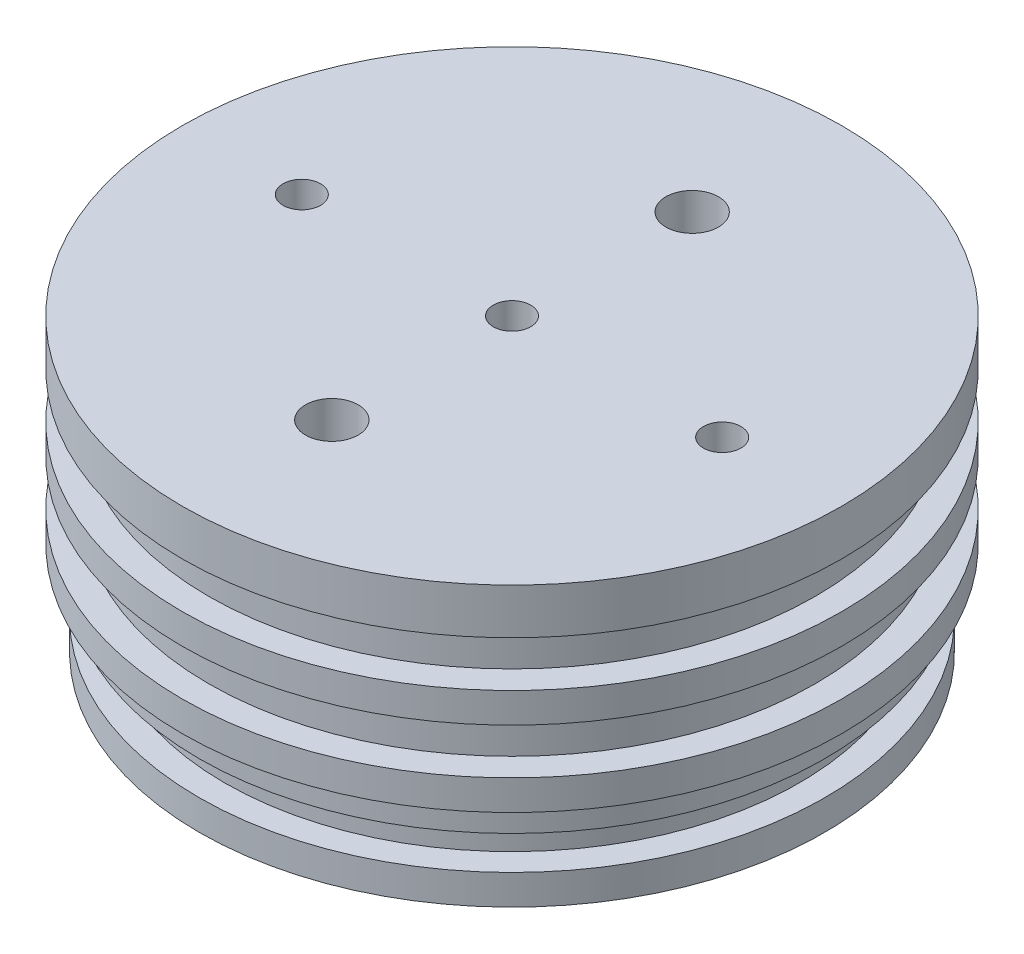
from build123d import *

# Parameters (mm, degrees)
SKETCH1_R                         = 69.723
BOSS_EXTRUDE1_DEPTH               = 41.656
SKETCH3_W                         = 5.588
SKETCH3_H                         = 9.652
SKETCH4_R                         = 66.167
BOSS_EXTRUDE2_DEPTH               = 19.8374
SKETCH5_W                         = 5.3975
SKETCH5_H                         = 7.1374
PIPE_TAP_DRILL_FOR_1_4_TAP1_D     = 11.1252
TAP_DRILL_FOR_3_8_16_TAP1_D       = 7.9375
TAP_DRILL_FOR_3_8_16_TAP1_DEPTH   = 25.4
TAP_DRILL_FOR_3_8_16_TAP1_TIP     = 2.384665582
PIPE_TAP_DRILL_FOR_1_4_TAP2_D     = 11.1252
PIPE_TAP_DRILL_FOR_1_4_TAP2_DEPTH = 61.4934
TAP_DRILL_FOR_3_8_16_TAP2_D       = 7.9375
TAP_DRILL_FOR_3_8_16_TAP2_DEPTH   = 19.05
TAP_DRILL_FOR_3_8_16_TAP2_TIP     = 2.384665582


with BuildPart() as part:
    # Sketch1 → Boss-Extrude1 (new body)
    with BuildSketch(Plane(origin=(0, 0, 0), x_dir=(1, 0, 0), z_dir=(0, 1, 0))):
        with Locations(Location((0, 0, 0), (0, 0, 270))):
            Circle(SKETCH1_R)
    extrude(amount=BOSS_EXTRUDE1_DEPTH)

    # Sketch3 → Cut-Revolve1 (revolve, cut)
    with BuildSketch(Plane(origin=(0, 0, 0), x_dir=(0, 0, -1), z_dir=(1, 0, 0)), mode=Mode.PRIVATE) as cut_revolve1_sk:
        with Locations((66.929, 27.178)):
            Rectangle(SKETCH3_W, SKETCH3_H)
        with Locations((66.929, 11.176)):
            Rectangle(SKETCH3_W, SKETCH3_H)
    revolve(cut_revolve1_sk.sketch.rotate(Axis((0, 41.656, 0), (0, -1, 0)), 180), axis=Axis((0, 41.656, 0), (0, -1, 0)), mode=Mode.SUBTRACT)

    # Sketch4 → Boss-Extrude2 (add)
    with BuildSketch(Plane.XZ):
        with Locations(Location((0, 0, 0), (0, 0, 270))):
            Circle(SKETCH4_R)
    extrude(amount=BOSS_EXTRUDE2_DEPTH)

    # Sketch5 → Cut-Revolve2 (revolve, cut)
    with BuildSketch(Plane(origin=(0, 0, 0), x_dir=(0, 0, -1), z_dir=(1, 0, 0)), mode=Mode.PRIVATE) as cut_revolve2_sk:
        with Locations((63.46825, -9.9187)):
            Rectangle(SKETCH5_W, SKETCH5_H)
    revolve(cut_revolve2_sk.sketch.rotate(Axis((0, 41.656, 0), (0, -1, 0)), 180), axis=Axis((0, 41.656, 0), (0, -1, 0)), mode=Mode.SUBTRACT)

    # Pipe Tap Drill for 1/4 Tap1 (through all)
    with Locations(Plane(origin=(0, 41.656, -38.1), x_dir=(0, 0, 1), z_dir=(0, 1, 0))):
        with Locations((0, 0)):
            pipe_tap_drill_for_1_4_tap1 = Hole(PIPE_TAP_DRILL_FOR_1_4_TAP1_D / 2)

    # Mirror1: Pipe Tap Drill for 1/4 Tap1 across plane
    add(pipe_tap_drill_for_1_4_tap1.mirror(Plane.XY), mode=Mode.SUBTRACT)

    # Tap Drill for 3/8-16 Tap1
    with Locations(Plane.ZX.offset(41.656)):
        with Locations((0, 0)):
            Hole(TAP_DRILL_FOR_3_8_16_TAP1_D / 2, depth=TAP_DRILL_FOR_3_8_16_TAP1_DEPTH)
            with Locations((0, 0, -(TAP_DRILL_FOR_3_8_16_TAP1_DEPTH + TAP_DRILL_FOR_3_8_16_TAP1_TIP / 2))):  # 118° drill point
                Cone(0, TAP_DRILL_FOR_3_8_16_TAP1_D / 2, TAP_DRILL_FOR_3_8_16_TAP1_TIP, mode=Mode.SUBTRACT)

    # Pipe Tap Drill for 1/4 Tap2
    with Locations(Plane(origin=(0, 41.656, 38.1), x_dir=(0, 0, 1), z_dir=(0, 1, 0))):
        with Locations((0, 0), (-76.2, 0)):
            Hole(PIPE_TAP_DRILL_FOR_1_4_TAP2_D / 2, depth=PIPE_TAP_DRILL_FOR_1_4_TAP2_DEPTH)

    # Tap Drill for 3/8-16 Tap2
    with Locations(Plane(origin=(-44.45, 41.656, 0), x_dir=(0, 0, 1), z_dir=(0, 1, 0))):
        with Locations((0, 0), (0, 88.9)):
            Hole(TAP_DRILL_FOR_3_8_16_TAP2_D / 2, depth=TAP_DRILL_FOR_3_8_16_TAP2_DEPTH)
            with Locations((0, 0, -(TAP_DRILL_FOR_3_8_16_TAP2_DEPTH + TAP_DRILL_FOR_3_8_16_TAP2_TIP / 2))):  # 118° drill point
                Cone(0, TAP_DRILL_FOR_3_8_16_TAP2_D / 2, TAP_DRILL_FOR_3_8_16_TAP2_TIP, mode=Mode.SUBTRACT)


solid = part.part
